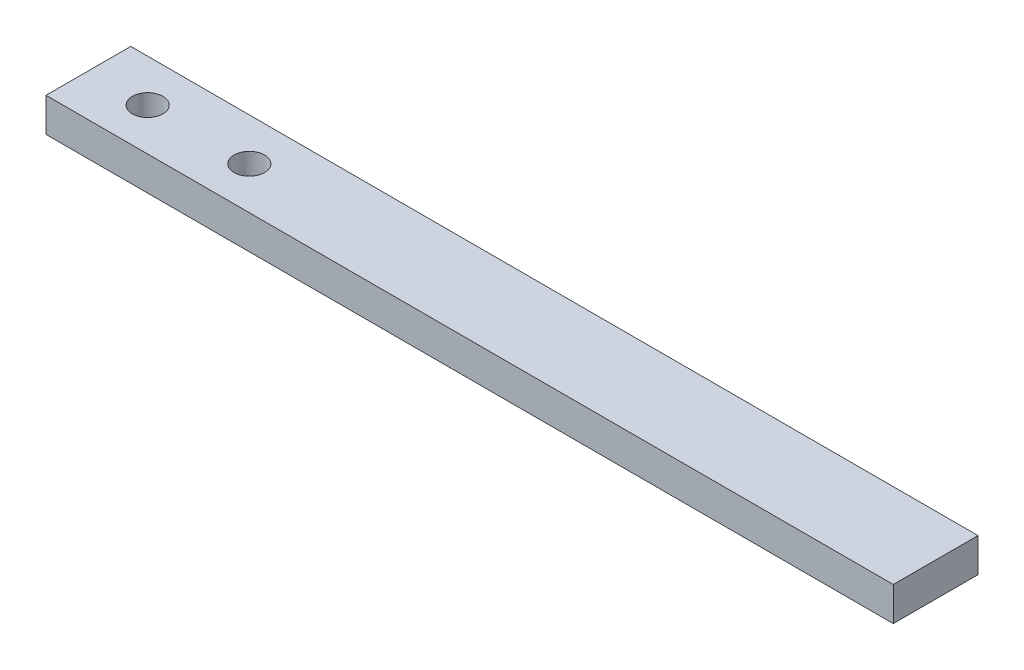
from build123d import *

# Parameters (mm, degrees)
SKETCH_1_W          = 50
SKETCH_1_H          = 5
EXTRUDE_1_DEPTH     = 2
SKETCH_2_R          = 0.9
CUT_EXTRUDE_1_DEPTH = 2


with BuildPart() as part:
    # 草图1 → 凸台-拉伸1 (new body)
    with BuildSketch(Plane(origin=(0, 0, 0), x_dir=(1, 0, 0), z_dir=(0, 1, 0))):
        with Locations((20.817327097, 0.942667455)):
            Rectangle(SKETCH_1_W, SKETCH_1_H)
    extrude(amount=EXTRUDE_1_DEPTH)

    # 草图2 → 切除-拉伸1 (cut)
    with BuildSketch(Plane(origin=(0, 2, 0), x_dir=(1, 0, 0), z_dir=(0, 1, 0))):
        with Locations(Location((-0.682672903, 0.942667455, 0), (0, 0, 270))):
            Circle(SKETCH_2_R)
        with Locations(Location((5.317327097, 0.942667455, 0), (0, 0, 270))):
            Circle(SKETCH_2_R)
    extrude(amount=-CUT_EXTRUDE_1_DEPTH, mode=Mode.SUBTRACT)


solid = part.part
